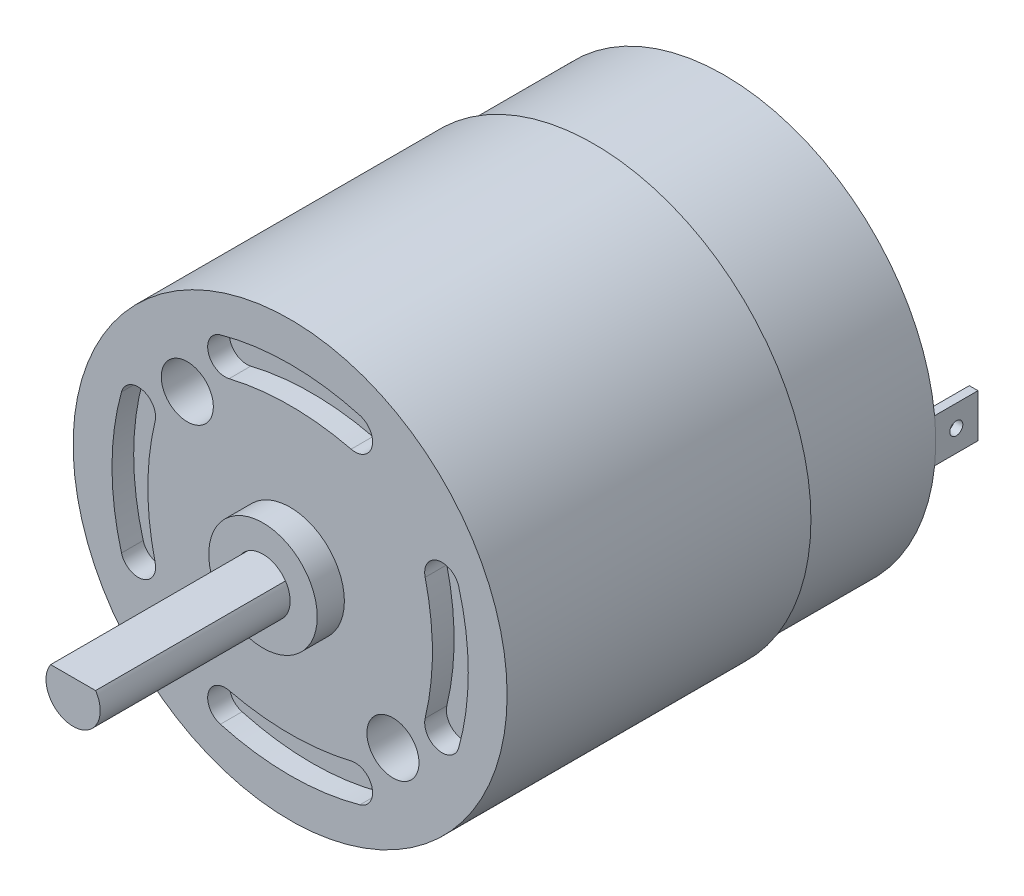
from build123d import *

# Parameters (mm, degrees)
SKETCH2_R           = 12.7
BOSS_EXTRUDE1_DEPTH = 12.7
SKETCH3_R           = 3.175
SKETCH3_R_2         = 1.5875
BOSS_EXTRUDE2_DEPTH = 1.5875
SKETCH4_R           = 1.5875
BOSS_EXTRUDE3_DEPTH = 12.7
CUT_EXTRUDE1_START  = -12.7
CUT_EXTRUDE1_DEPTH  = 12.7
CUT_EXTRUDE2_DEPTH  = 1.27
CIRPATTERN1_COUNT   = 4
SKETCH7_R           = 1.524
CUT_EXTRUDE3_DEPTH  = 5.08
CUT_EXTRUDE4_START  = -7.62
SKETCH8_R           = 12.7
SKETCH8_R_2         = 12.3825
CUT_EXTRUDE4_DEPTH  = 7.62
SKETCH9_R           = 1.27
CUT_EXTRUDE5_DEPTH  = 2.54
SKETCH11_W          = 0.508
SKETCH11_H          = 2.54
BOSS_EXTRUDE4_DEPTH = 2.54
SKETCH12_R          = 0.381
CUT_EXTRUDE6_DEPTH  = 2.54


with BuildPart() as part:
    # Sketch2 → Boss-Extrude1 (new, symmetric)
    with BuildSketch(Plane.XY):
        Circle(SKETCH2_R)
    extrude(amount=BOSS_EXTRUDE1_DEPTH, both=True)

    # Sketch3 → Boss-Extrude2 (add, symmetric)
    with BuildSketch(Plane.XY.offset(12.7)):
        Circle(SKETCH3_R)
        Circle(SKETCH3_R_2, mode=Mode.SUBTRACT)
    extrude(amount=BOSS_EXTRUDE2_DEPTH, both=True)

    # Sketch4 → Boss-Extrude3 (add)
    with BuildSketch(Plane.XY.offset(12.7)):
        Circle(SKETCH4_R)
    extrude(amount=BOSS_EXTRUDE3_DEPTH)

    # Sketch5 → Cut-Extrude1 (cut)
    with BuildSketch(Plane.XY.offset(25.4).offset(CUT_EXTRUDE1_START)):
        with BuildLine():
            Line((-1.315232014, 0.889), (1.315232014, 0.889))
            ThreePointArc((1.315232014, 0.889), (0, 1.5875), (-1.315232014, 0.889))
        make_face()
    extrude(amount=CUT_EXTRUDE1_DEPTH, mode=Mode.SUBTRACT)

    # Sketch6 → Cut-Extrude2 (cut)
    with BuildSketch(Plane.XY.offset(12.7)):
        with BuildLine():
            ThreePointArc((-4.082142857, 9.868873978), (-4.793434391, 8.634827903), (-3.571875, 7.902299395))
            ThreePointArc((-3.571875, 7.902299395), (0, 8.326790326), (3.571875, 7.902299395))
            ThreePointArc((3.571875, 7.902299395), (4.793434391, 8.634827903), (4.082142857, 9.868873978))
            ThreePointArc((4.082142857, 9.868873978), (0, 10.425764304), (-4.082142857, 9.868873978))
        make_face()
    cut_extrude2 = extrude(amount=-CUT_EXTRUDE2_DEPTH, mode=Mode.SUBTRACT)

    # CirPattern1: Cut-Extrude2 ×4 about axis
    cirpattern1_axis = Axis((0, 0, 0), (0, 0, 1))
    for i in range(1, CIRPATTERN1_COUNT):
        add(cut_extrude2.rotate(cirpattern1_axis, i * 360 / CIRPATTERN1_COUNT), mode=Mode.SUBTRACT)

    # Sketch7 → Cut-Extrude3 (cut)
    with BuildSketch(Plane.XY.offset(12.7)):
        with Locations((-6.016771601, 6.016771601)):
            Circle(SKETCH7_R)
        with Locations((6.016771601, -6.016771601)):
            Circle(SKETCH7_R)
    extrude(amount=-CUT_EXTRUDE3_DEPTH, mode=Mode.SUBTRACT)

    # Sketch8 → Cut-Extrude4 (cut)
    with BuildSketch(Plane(origin=(0, 0, -12.7), x_dir=(-1, 0, 0), z_dir=(0, 0, -1)).offset(CUT_EXTRUDE4_START)):
        with Locations(Location((0, 0, 0), (0, 0, 180))):
            Circle(SKETCH8_R)
        Circle(SKETCH8_R_2, mode=Mode.SUBTRACT)
    extrude(amount=CUT_EXTRUDE4_DEPTH, mode=Mode.SUBTRACT)

    # Sketch9 → Cut-Extrude5 (cut)
    with BuildSketch(Plane(origin=(0, 0, -12.7), x_dir=(-1, 0, 0), z_dir=(0, 0, -1))):
        with Locations((-3.175, 0)):
            Circle(SKETCH9_R)
        with Locations((3.175, 0)):
            Circle(SKETCH9_R)
    extrude(amount=-CUT_EXTRUDE5_DEPTH, mode=Mode.SUBTRACT)

    # Sketch11 → Boss-Extrude4 (add)
    with BuildSketch(Plane(origin=(0, 0, -12.7), x_dir=(-1, 0, 0), z_dir=(0, 0, -1))):
        with Locations((-12.063199611, 0)):
            Rectangle(SKETCH11_W, SKETCH11_H)
    boss_extrude4 = extrude(amount=BOSS_EXTRUDE4_DEPTH)

    # Sketch12 → Cut-Extrude6 (cut)
    with BuildSketch(Plane(origin=(12.317199611, 0, 0), x_dir=(0, 0, -1), z_dir=(1, 0, 0))):
        with Locations((13.97, 0)):
            Circle(SKETCH12_R)
    cut_extrude6 = extrude(amount=-CUT_EXTRUDE6_DEPTH, mode=Mode.SUBTRACT)

    # Mirror1: Boss-Extrude4, Cut-Extrude6 across plane
    add(boss_extrude4.mirror(Plane(origin=(0, 0, 0), x_dir=(0, 0, 1), z_dir=(1, 0, 0))))
    add(cut_extrude6.mirror(Plane(origin=(0, 0, 0), x_dir=(0, 0, 1), z_dir=(1, 0, 0))), mode=Mode.SUBTRACT)


solid = part.part
